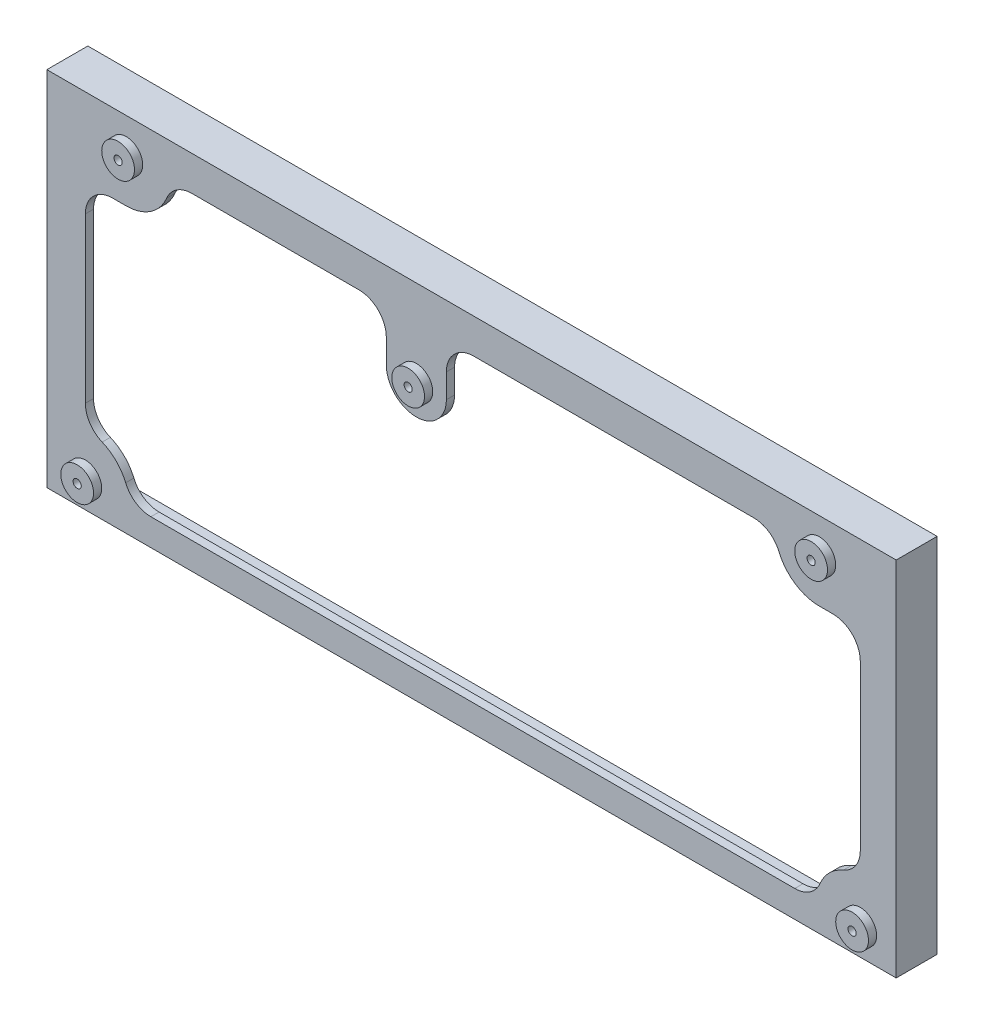
from build123d import *

# Parameters (mm, degrees)
SKETCH1_R                             = 6
SKETCH1_R_2                           = 1.5
DISPLAY_SCREW_PATTERN_DEPTH           = 3
DISPLAY_SCREW_PATTERN_2_DEPTH         = 3
DISPLAY_SCREW_PATTERN_3_DEPTH         = 3
DISPLAY_SCREW_PATTERN_4_DEPTH         = 3
DISPLAY_SCREW_PATTERN_5_DEPTH         = 3
SKETCH2_W                             = 311.1
SKETCH2_H                             = 132.6
SKETCH2_R                             = 4
DISPLAY_BACKPLANE_DEPTH               = 3
BACKPLANE_WEIGHT_REDUCTION_DEPTH      = 203.770122306
BACKPLANE_WEIGHT_REDUCTION_DEPTH_BACK = 203.770122306
SKETCH4_W                             = 311.1
SKETCH4_H                             = 132.6
SKETCH4_W_2                           = 309.1
SKETCH4_H_2                           = 130.6
DISPLAY_OUTSIDE_CRADDLE_DEPTH         = 12


with BuildPart() as part:
    # Sketch1 → Display screw pattern (new body)
    with BuildSketch(Plane.XY):
        Circle(SKETCH1_R)
        Circle(SKETCH1_R_2, mode=Mode.SUBTRACT)
    extrude(amount=DISPLAY_SCREW_PATTERN_DEPTH)



with BuildPart() as body_2:
    # Sketch1 → Display screw pattern 2 (new body)
    with BuildSketch(Plane.XY):
        with Locations((-106.24, 18.83)):
            Circle(SKETCH1_R)
        with Locations((-106.24, 18.83)):
            Circle(SKETCH1_R_2, mode=Mode.SUBTRACT)
    extrude(amount=DISPLAY_SCREW_PATTERN_2_DEPTH)


with BuildPart() as body_3:
    # Sketch1 → Display screw pattern 3 (new body)
    with BuildSketch(Plane.XY):
        with Locations((147.61, 18.83)):
            Circle(SKETCH1_R)
        with Locations((147.61, 18.83)):
            Circle(SKETCH1_R_2, mode=Mode.SUBTRACT)
    extrude(amount=DISPLAY_SCREW_PATTERN_3_DEPTH)


with BuildPart() as body_4:
    # Sketch1 → Display screw pattern 4 (new body)
    with BuildSketch(Plane.XY):
        with Locations((-121.24, -91.25)):
            Circle(SKETCH1_R)
        with Locations((-121.24, -91.25)):
            Circle(SKETCH1_R_2, mode=Mode.SUBTRACT)
    extrude(amount=DISPLAY_SCREW_PATTERN_4_DEPTH)


with BuildPart() as body_5:
    # Sketch1 → Display screw pattern 5 (new body)
    with BuildSketch(Plane.XY):
        with Locations((162.61, -91.25)):
            Circle(SKETCH1_R)
        with Locations((162.61, -91.25)):
            Circle(SKETCH1_R_2, mode=Mode.SUBTRACT)
    extrude(amount=DISPLAY_SCREW_PATTERN_5_DEPTH)


with BuildPart() as part_1:
    add(part.part)

    add(body_2.part)  # Display backplane merges body 2

    add(body_3.part)  # Display backplane merges body 3

    add(body_4.part)  # Display backplane merges body 4

    add(body_5.part)  # Display backplane merges body 5
    # Sketch2 → Display backplane (add)
    with BuildSketch(Plane(origin=(0, 0, 0), x_dir=(-1, 0, 0), z_dir=(0, 0, -1))):
        with Locations((-20.21, -34.77)):
            Rectangle(SKETCH2_W, SKETCH2_H)
        with Locations((106.24, 18.83)):
            Circle(SKETCH2_R, mode=Mode.SUBTRACT)
        Circle(SKETCH2_R, mode=Mode.SUBTRACT)
        with Locations((121.24, -91.25)):
            Circle(SKETCH2_R, mode=Mode.SUBTRACT)
        with Locations((-147.61, 18.83)):
            Circle(SKETCH2_R, mode=Mode.SUBTRACT)
        with Locations((-162.61, -91.25)):
            Circle(SKETCH2_R, mode=Mode.SUBTRACT)
    extrude(amount=DISPLAY_BACKPLANE_DEPTH)

    # Sketch3 → Backplane weight reduction (cut, two sides: drawn at the far end of the back side and taken through both)
    with BuildSketch(Plane.XY.offset(-BACKPLANE_WEIGHT_REDUCTION_DEPTH_BACK)):
        with BuildLine():
            Line((162.61, -7.17), (162.61, -67.25))
            ThreePointArc((162.61, -67.25), (160.930502943, -72.797001962), (156.456153846, -76.480769231))
            ThreePointArc((156.456153846, -76.480769231), (151.296291501, -79.936291501), (147.840769231, -85.096153846))
            ThreePointArc((147.840769231, -85.096153846), (144.157001962, -89.570502943), (138.61, -91.25))
            Line((138.61, -91.25), (-97.24, -91.25))
            ThreePointArc((-97.24, -91.25), (-102.787001962, -89.570502943), (-106.470769231, -85.096153846))
            ThreePointArc((-106.470769231, -85.096153846), (-109.926291501, -79.936291501), (-115.086153846, -76.480769231))
            ThreePointArc((-115.086153846, -76.480769231), (-119.560502943, -72.797001962), (-121.24, -67.25))
            Line((-121.24, -67.25), (-121.24, -7.17))
            ThreePointArc((-121.24, -7.17), (-118.311067812, -0.098932188), (-111.24, 2.83))
            Line((-111.24, 2.83), (-106.24, 2.83))
            ThreePointArc((-106.24, 2.83), (-97.36479686, 5.517195291), (-91.470769231, 12.676153846))
            ThreePointArc((-91.470769231, 12.676153846), (-87.787001962, 17.150502943), (-82.24, 18.83))
            Line((-82.24, 18.83), (-21, 18.83))
            ThreePointArc((-21, 18.83), (-13.928932188, 15.901067812), (-11, 8.83))
            Line((-11, 8.83), (-11, 0))
            ThreePointArc((-11, 0), (0, -11), (11, 0))
            Line((11, 0), (11, 8.83))
            ThreePointArc((11, 8.83), (13.928932188, 15.901067812), (21, 18.83))
            Line((21, 18.83), (123.61, 18.83))
            ThreePointArc((123.61, 18.83), (129.157001962, 17.150502943), (132.840769231, 12.676153846))
            ThreePointArc((132.840769231, 12.676153846), (138.73479686, 5.517195291), (147.61, 2.83))
            Line((147.61, 2.83), (152.61, 2.83))
            ThreePointArc((152.61, 2.83), (159.681067812, -0.098932188), (162.61, -7.17))
        make_face()
    extrude(amount=BACKPLANE_WEIGHT_REDUCTION_DEPTH + BACKPLANE_WEIGHT_REDUCTION_DEPTH_BACK, mode=Mode.SUBTRACT)

    # Sketch4 → Display outside craddle (add)
    with BuildSketch(Plane(origin=(0, 0, -3), x_dir=(-1, 0, 0), z_dir=(0, 0, -1))):
        with Locations((-20.21, -34.77)):
            Rectangle(SKETCH4_W, SKETCH4_H)
        with Locations((-20.21, -34.77)):
            Rectangle(SKETCH4_W_2, SKETCH4_H_2, mode=Mode.SUBTRACT)
    extrude(amount=DISPLAY_OUTSIDE_CRADDLE_DEPTH)


solid = part_1.part
